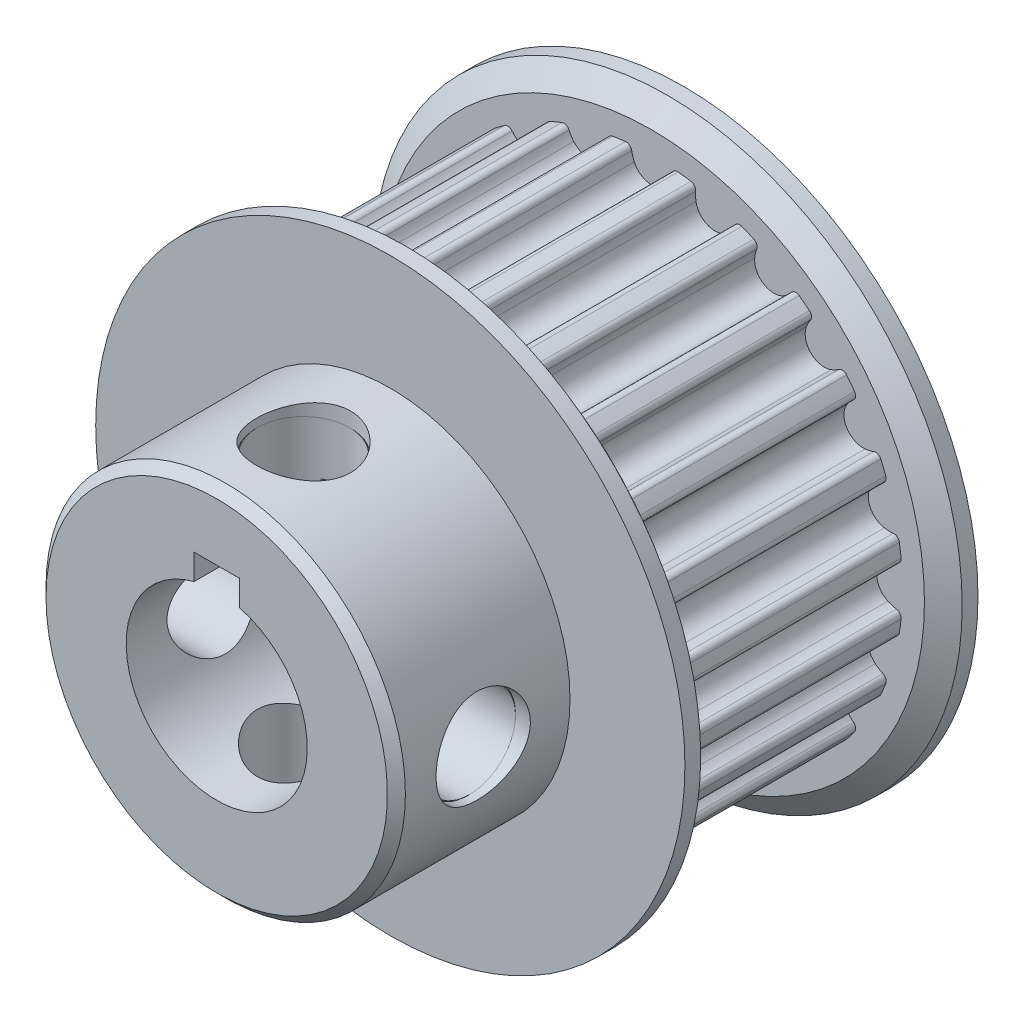
from build123d import *

# Parameters (mm, degrees)
CUT_EXTRUDE1_START      = 1.245
CUT_EXTRUDE1_DEPTH      = 10.16
CIRPATTERN1_COUNT       = 24
SKETCH4_R               = 2.0828
CUT_EXTRUDE2_DEPTH      = 22.099922097
CUT_EXTRUDE3_DEPTH      = 1.5621
CIRPATTERN2_COUNT       = 2
CIRPATTERN2_ANGLE       = 90
CHAMFER1_SIZE           = 0.397
CUT_EXTRUDE6_DEPTH      = 28.642268659
CUT_EXTRUDE6_DEPTH_BACK = 28.642268659
SKETCH9_R               = 4
CUT_EXTRUDE7_DEPTH      = 27.521524084
CUT_EXTRUDE7_DEPTH_BACK = 27.521524084
SKETCH10_R              = 2.032
SKETCH11_R              = 2.032
CUT_EXTRUDE8_DEPTH      = 20.828
CUT_EXTRUDE9_DEPTH      = 28.642268659
CUT_EXTRUDE9_DEPTH_BACK = 28.642268659
SKETCH12_W              = 2
SKETCH12_H              = 2


with BuildPart() as part:
    # Sketch2 → Revolve1 (revolve)
    with BuildSketch(Plane(origin=(0, 0, 0), x_dir=(0, 0, -1), z_dir=(1, 0, 0)), mode=Mode.PRIVATE) as revolve1_sk:
        Polygon((-10.31, 3.175), (10.31, 3.175), (10.31, 13.0175), (9.6125, 13.0175), (8.915, 12.046), (8.915, 11.0745), (-1.245, 11.0745), (-1.245, 12.046), (-1.9425, 13.0175), (-2.64, 13.0175), (-2.64, 7.94), (-10.31, 7.94), align=None)
    revolve(revolve1_sk.sketch.rotate(Axis((0, 0, 10.31), (0, 0, -1)), 90), axis=Axis((0, 0, 10.31), (0, 0, -1)))

    # Sketch3 → Cut-Extrude1 (cut)
    with BuildSketch(Plane.XY.offset(CUT_EXTRUDE1_START)):
        with BuildLine():
            Line((3.499719537, 13.0175), (-3.499719537, 13.0175))
            Line((-3.499719537, 13.0175), (-2.875251976, 10.694740592))
            ThreePointArc((-2.875251976, 10.694740592), (-2.024483834, 10.887883883), (-1.161152096, 11.01345886))
            ThreePointArc((-1.161152096, 11.01345886), (-0.983914058, 10.96406339), (-0.88847938, 10.806756502))
            ThreePointArc((-0.88847938, 10.806756502), (-0.843250935, 10.616137701), (-0.773880597, 10.432919538))
            ThreePointArc((-0.773880597, 10.432919538), (0, 9.9345), (0.773880597, 10.432919538))
            ThreePointArc((0.773880597, 10.432919538), (0.843250935, 10.616137701), (0.88847938, 10.806756502))
            ThreePointArc((0.88847938, 10.806756502), (0.983914058, 10.96406339), (1.161152096, 11.01345886))
            ThreePointArc((1.161152096, 11.01345886), (2.024483834, 10.887883883), (2.875251976, 10.694740592))
            Line((2.875251976, 10.694740592), (3.499719537, 13.0175))
        make_face()
    cut_extrude1 = extrude(amount=-CUT_EXTRUDE1_DEPTH, mode=Mode.SUBTRACT)

    # CirPattern1: Cut-Extrude1 ×24 about axis
    cirpattern1_axis = Axis((0, 0, 0), (0, 0, 1))
    for i in range(1, CIRPATTERN1_COUNT):
        add(cut_extrude1.rotate(cirpattern1_axis, i * 360 / CIRPATTERN1_COUNT), mode=Mode.SUBTRACT)

    # Sketch4 → Cut-Extrude2 (cut, through all)
    with BuildSketch(Plane(origin=(0, 0, 0), x_dir=(0, -1, 0), z_dir=(1, 0, 0))):
        with Locations(Location((0, -6.475, 0), (0, 0, 270))):
            Circle(SKETCH4_R)
    cut_extrude2 = extrude(amount=CUT_EXTRUDE2_DEPTH, mode=Mode.SUBTRACT)

    # Sketch5 → Revolve2 (revolve)
    with BuildSketch(Plane.XY.offset(6.475)):
        Polygon((3.175, -1.7018), (3.175, 0), (7.66195433, 0), (7.66195433, -1.7018), (7.28095433, -2.0828), (3.556, -2.0828), align=None)
    revolve2 = revolve(axis=Axis((3.175, 0, 6.475), (1, 0, 0)))

    # Sketch6 → Cut-Extrude3 (cut)
    with BuildSketch(Plane(origin=(7.66195433, 5.384140679, 0), x_dir=(0, -1, 0), z_dir=(-1, 0, 0))):
        Polygon((5.384140679, 7.677505141), (4.342740679, 7.07625257), (4.342740679, 5.87374743), (5.384140679, 5.272494859), (6.425540679, 5.87374743), (6.425540679, 7.07625257), align=None)
    cut_extrude3 = extrude(amount=CUT_EXTRUDE3_DEPTH, mode=Mode.SUBTRACT)

    # CirPattern2: Cut-Extrude2, Revolve2, Cut-Extrude3 ×2 about axis
    cirpattern2_axis = Axis((0, 0, 0), (0, 0, 1))
    add([cut_extrude2.rotate(cirpattern2_axis, i * CIRPATTERN2_ANGLE / (CIRPATTERN2_COUNT - 1)) for i in range(1, CIRPATTERN2_COUNT)], mode=Mode.SUBTRACT)
    add([revolve2.rotate(cirpattern2_axis, i * CIRPATTERN2_ANGLE / (CIRPATTERN2_COUNT - 1)) for i in range(1, CIRPATTERN2_COUNT)])
    add([cut_extrude3.rotate(cirpattern2_axis, i * CIRPATTERN2_ANGLE / (CIRPATTERN2_COUNT - 1)) for i in range(1, CIRPATTERN2_COUNT)], mode=Mode.SUBTRACT)

    # Chamfer1
    chamfer1_edges = [part.edges().sort_by_distance(p)[0] for p in [
        (-7.94, 0, 10.31),
        (-3.175, 0, 10.31),
    ]]
    chamfer(chamfer1_edges, length=CHAMFER1_SIZE)

    # Sketch9 → Cut-Extrude6 (cut, two sides: drawn at the far end of the back side and taken through both)
    with BuildSketch(Plane.XY.offset(10.31).offset(-CUT_EXTRUDE6_DEPTH_BACK)):
        Circle(SKETCH9_R)
    extrude(amount=CUT_EXTRUDE6_DEPTH + CUT_EXTRUDE6_DEPTH_BACK, mode=Mode.SUBTRACT)

    # Sketch10 → Cut-Extrude7 (cut, two sides: drawn at the far end of the back side and taken through both)
    with BuildSketch(Plane(origin=(7.66195433, 0, 0), x_dir=(0, 0, -1), z_dir=(1, 0, 0)).offset(-CUT_EXTRUDE7_DEPTH_BACK)):
        with Locations(Location((-6.475, 0, 0), (0, 0, 71.506205297))):
            Circle(SKETCH10_R)
    extrude(amount=CUT_EXTRUDE7_DEPTH + CUT_EXTRUDE7_DEPTH_BACK, mode=Mode.SUBTRACT)

    # Sketch11 → Cut-Extrude8 (cut)
    with BuildSketch(Plane(origin=(0, 7.66195433, 0), x_dir=(1, 0, 0), z_dir=(0, 1, 0))):
        with Locations(Location((0, -6.475, 0), (0, 0, 161.506192496))):
            Circle(SKETCH11_R)
    extrude(amount=-CUT_EXTRUDE8_DEPTH, mode=Mode.SUBTRACT)

    # Sketch12 → Cut-Extrude9 (cut, two sides: drawn at the far end of the back side and taken through both)
    with BuildSketch(Plane.XY.offset(10.31).offset(-CUT_EXTRUDE9_DEPTH_BACK)):
        with Locations((0, 4)):
            Rectangle(SKETCH12_W, SKETCH12_H)
    extrude(amount=CUT_EXTRUDE9_DEPTH + CUT_EXTRUDE9_DEPTH_BACK, mode=Mode.SUBTRACT)


solid = part.part
